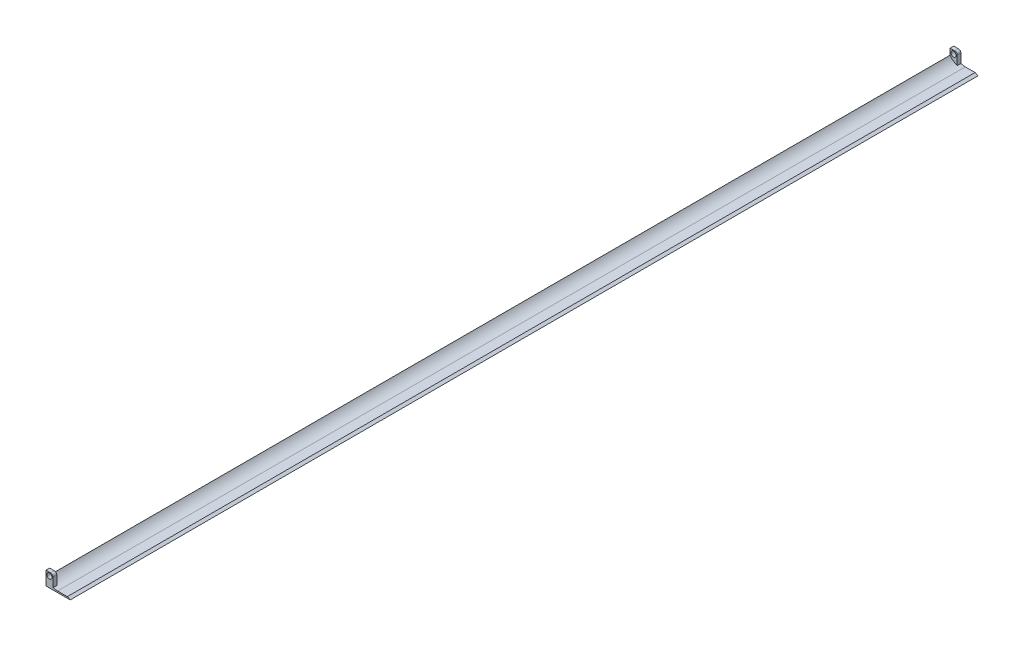
from build123d import *

# Parameters (mm, degrees)
BOSS_EXTRUDE1_DEPTH = 939.8
SKETCH2_R           = 2.667
BOSS_EXTRUDE2_DEPTH = 3.81
BOSS_EXTRUDE3_START = -3.81
SKETCH3_R           = 2.667
BOSS_EXTRUDE3_DEPTH = 3.81


with BuildPart() as part:
    # Sketch1 → Boss-Extrude1 (new body)
    with BuildSketch(Plane.XY):
        with BuildLine():
            Line((-7.360249805, 3.93392662), (-7.360249805, -3.970205312))
            Line((-7.360249805, -3.970205312), (7.360249805, -3.970205312))
            Line((7.360249805, -3.970205312), (17.707328311, -3.970205312))
            Line((17.707328311, -3.970205312), (14.73419743, -2.484193787))
            Line((14.73419743, -2.484193787), (4.584628721, -2.484193787))
            ThreePointArc((4.584628721, -2.484193787), (-2.195349018, -0.778057865), (-7.360249805, 3.93392662))
        make_face()
    extrude(amount=BOSS_EXTRUDE1_DEPTH)

    # Sketch2 → Boss-Extrude2 (add)
    with BuildSketch(Plane.XY.offset(939.8)):
        with BuildLine():
            Line((-7.360249805, -3.970205312), (0, -3.970205312))
            Line((0, -3.970205312), (0, 7.640068299))
            ThreePointArc((0, 7.640068299), (-0.743948776, 9.436119523), (-2.54, 10.180068299))
            Line((-2.54, 10.180068299), (-7.360249805, 10.180068299))
            Line((-7.360249805, 10.180068299), (-7.360249805, -3.970205312))
        make_face()
        with Locations((-3.81, 6.741214638)):
            Circle(SKETCH2_R, mode=Mode.SUBTRACT)
    extrude(amount=-BOSS_EXTRUDE2_DEPTH)

    # Sketch3 → Boss-Extrude3 (add)
    with BuildSketch(Plane(origin=(0, 0, 0), x_dir=(-1, 0, 0), z_dir=(0, 0, -1)).offset(BOSS_EXTRUDE3_START)):
        with BuildLine():
            Line((0, -1.730708485), (0, -3.970205312))
            Line((0, -3.970205312), (7.360249805, -3.970205312))
            Line((7.360249805, -3.970205312), (7.360249805, 3.93392662))
            Line((7.360249805, 3.93392662), (7.360249805, 10.180068299))
            Line((7.360249805, 10.180068299), (2.54, 10.180068299))
            ThreePointArc((2.54, 10.180068299), (0.743948776, 9.436119523), (0, 7.640068299))
            Line((0, 7.640068299), (0, -1.730708485))
        make_face()
        with Locations(Location((3.81, 6.741214638, 0), (0, 0, 180))):
            Circle(SKETCH3_R, mode=Mode.SUBTRACT)
    extrude(amount=BOSS_EXTRUDE3_DEPTH)


solid = part.part
